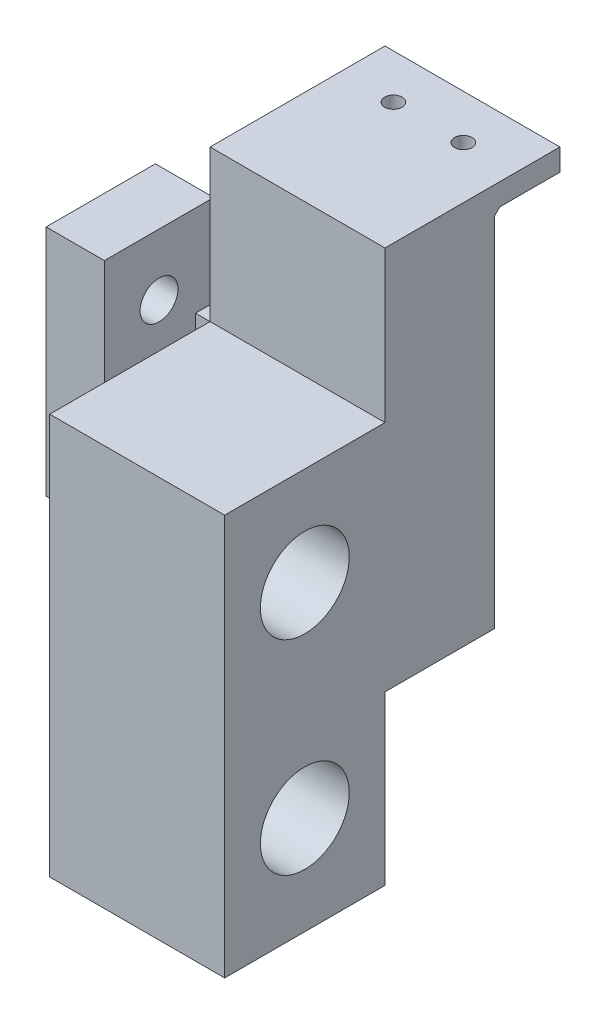
from build123d import *

# Parameters (mm, degrees)
SKETCH1_R           = 3.1
SKETCH1_R_2         = 2.5
BOSS_EXTRUDE1_DEPTH = 15
BOSS_EXTRUDE3_START = -5
SKETCH6_R           = 3.1
BOSS_EXTRUDE3_DEPTH = 5
BOSS_EXTRUDE4_DEPTH = 15
SKETCH8_R           = 2.6
CUT_EXTRUDE3_DEPTH  = 27
CUT_EXTRUDE4_DEPTH  = 89.777895192
SKETCH11_W          = 24
SKETCH11_H          = 0.25
BOSS_EXTRUDE5_DEPTH = 15
SKETCH12_W          = 24
SKETCH12_H          = 32
SKETCH12_H_2        = 23
BOSS_EXTRUDE6_DEPTH = 22
SKETCH13_R          = 6.1
CUT_EXTRUDE5_DEPTH  = 59.362710124
SKETCH14_W          = 24
SKETCH14_H          = 9
SKETCH14_R          = 1.2
BOSS_EXTRUDE7_DEPTH = 3
CHAMFER1_SIZE       = 2.5
CHAMFER2_SIZE       = 0.75


with BuildPart() as part:
    # Sketch1 → Boss-Extrude1 (new body)
    with BuildSketch(Plane.XY):
        with BuildLine():
            Line((-25.80048806, 37.524276553), (-49.80048806, 37.524276553))
            Line((-49.80048806, 37.524276553), (-49.80048806, -14.975723447))
            Line((-49.80048806, -14.975723447), (-41.80048806, -45.286414829))
            ThreePointArc((-41.80048806, -45.286414829), (-37.80048806, -49.286414829), (-33.80048806, -45.286414829))
            Line((-33.80048806, -45.286414829), (-25.80048806, -14.975723447))
            Line((-25.80048806, -14.975723447), (-25.80048806, 37.524276553))
        make_face()
        with Locations((-37.80048806, 25.524276553)):
            Circle(SKETCH1_R, mode=Mode.SUBTRACT)
        with Locations((-37.80048806, -2.975723447)):
            Circle(SKETCH1_R, mode=Mode.SUBTRACT)
        with Locations((-37.80048806, -45.286414829)):
            Circle(SKETCH1_R_2, mode=Mode.SUBTRACT)
    extrude(amount=BOSS_EXTRUDE1_DEPTH)

    # Sketch6 → Boss-Extrude3 (add)
    with BuildSketch(Plane.XY.offset(15).offset(BOSS_EXTRUDE3_START)):
        with Locations((-37.80048806, -2.975723447)):
            Circle(SKETCH6_R)
        with Locations((-37.80048806, 25.524276553)):
            Circle(SKETCH6_R)
    extrude(amount=BOSS_EXTRUDE3_DEPTH)

    # Sketch7 → Boss-Extrude4 (add)
    with BuildSketch(Plane.XY.offset(15)):
        Polygon((-51.800511672, 16.774276553), (-49.80048806, 16.774276553), (-49.80048806, -15.225723447), (-72.300511672, -15.225723447), (-72.300511672, 16.774276553), (-64.300511672, 16.774276553), (-64.300511672, -7.225723447), (-58.050499866, -7.225723447), (-51.800511672, -7.225723447), align=None)
    extrude(amount=-BOSS_EXTRUDE4_DEPTH)

    # Sketch8 → Cut-Extrude3 (cut)
    with BuildSketch(Plane.ZY.offset(72.300511672)):
        with Locations((7.5, 8.346782821)):
            Circle(SKETCH8_R)
    extrude(amount=-CUT_EXTRUDE3_DEPTH, mode=Mode.SUBTRACT)

    # Sketch10 → Cut-Extrude4 (cut, through all)
    with BuildSketch(Plane.XY.offset(15)):
        Polygon((-49.80048806, -15.225723447), (-49.80048806, -14.975723447), (-25.80048806, -14.975723447), (-25.80048806, -50.615055613), (-49.80048806, -50.615055613), align=None)
    extrude(amount=-CUT_EXTRUDE4_DEPTH, mode=Mode.SUBTRACT)

    # Sketch11 → Boss-Extrude5 (add)
    with BuildSketch(Plane.XY.offset(15)):
        with Locations((-37.80048806, -15.100723447)):
            Rectangle(SKETCH11_W, SKETCH11_H)
    extrude(amount=-BOSS_EXTRUDE5_DEPTH)

    # Sketch12 → Boss-Extrude6 (add)
    with BuildSketch(Plane.XY.offset(15)):
        with Locations((-37.80048806, 0.774276553)):
            Rectangle(SKETCH12_W, SKETCH12_H)
        with Locations((-37.80048806, -26.725723447)):
            Rectangle(SKETCH12_W, SKETCH12_H_2)
    extrude(amount=BOSS_EXTRUDE6_DEPTH)

    # Sketch13 → Cut-Extrude5 (cut, through all)
    with BuildSketch(Plane.ZY.offset(49.80048806)):
        with Locations(Location((26, 3.274276553, 0), (0, 0, 270))):
            Circle(SKETCH13_R)
        with Locations(Location((26, -24.725723447, 0), (0, 0, 270))):
            Circle(SKETCH13_R)
    extrude(amount=-CUT_EXTRUDE5_DEPTH, mode=Mode.SUBTRACT)

    # Sketch14 → Boss-Extrude7 (add)
    with BuildSketch(Plane(origin=(0, 37.524276553, 0), x_dir=(1, 0, 0), z_dir=(0, 1, 0))):
        with Locations((-37.80048806, 4.5)):
            Rectangle(SKETCH14_W, SKETCH14_H)
        with Locations(Location((-32.95048806, 2.9, 0), (0, 0, 270))):
            Circle(SKETCH14_R, mode=Mode.SUBTRACT)
        with Locations(Location((-42.55048806, 2.9, 0), (0, 0, 270))):
            Circle(SKETCH14_R, mode=Mode.SUBTRACT)
    extrude(amount=-BOSS_EXTRUDE7_DEPTH)

    # Chamfer1
    chamfer1_edges = [part.edges().sort_by_distance(p)[0] for p in [
        (-64.300511672, -7.225723447, 7.5),
        (-51.800511672, -7.225723447, 7.5),
    ]]
    chamfer(chamfer1_edges, length=CHAMFER1_SIZE)

    # Chamfer2
    chamfer2_edges = [part.edges().sort_by_distance(p)[0] for p in [
        (-37.80048806, 34.524276553, 0),
    ]]
    chamfer(chamfer2_edges, length=CHAMFER2_SIZE)


solid = part.part
